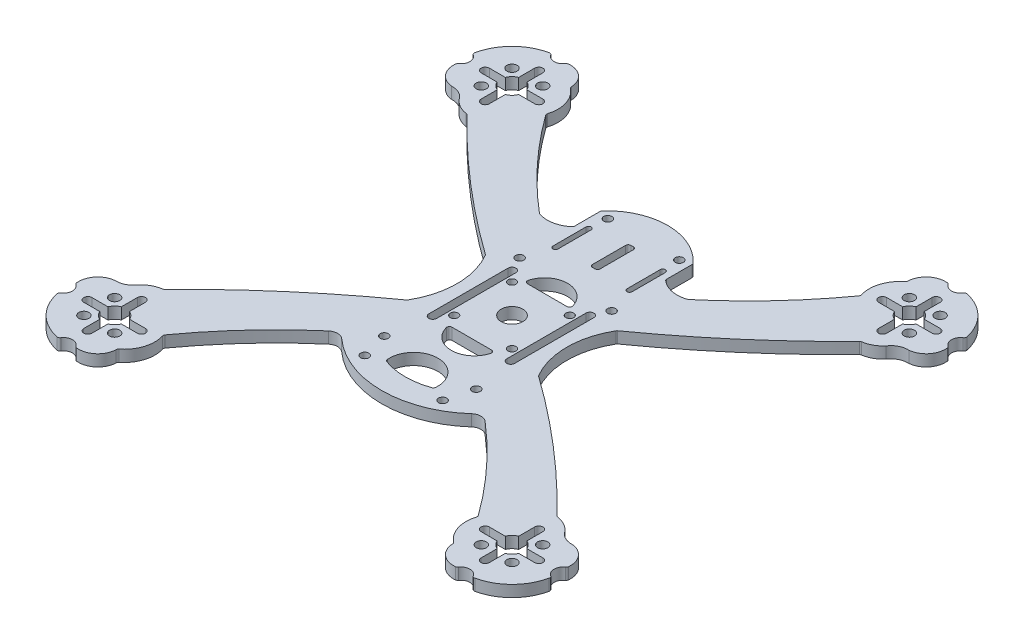
from build123d import *

# Parameters (mm, degrees)
SKETCH1_R           = 4.25
SKETCH1_R_2         = 1.598962018
SKETCH1_R_3         = 1.6
SKETCH1_R_4         = 2
SKETCH1_R_5         = 1.55
BOSS_EXTRUDE1_DEPTH = 4.5


with BuildPart() as part:
    # Sketch1 → Boss-Extrude1 (new body)
    with BuildSketch(Plane(origin=(0, 0, 0), x_dir=(1, 0, 0), z_dir=(0, 1, 0))):
        with BuildLine():
            Line((-18, 52.491933385), (-18, 42.570977291))
            ThreePointArc((-18, 42.570977291), (-18.090991941, 42.154198754), (-18.347408697, 41.813267193))
            ThreePointArc((-18.347408697, 41.813267193), (-23.441061006, 39.374833013), (-29.069059648, 39.840543614))
            ThreePointArc((-29.069059648, 39.840543614), (-46.242097232, 56.168911766), (-61.280064427, 74.482523343))
            ThreePointArc((-61.280064427, 74.482523343), (-61.456366133, 74.905913234), (-61.425121286, 75.363477492))
            ThreePointArc((-61.425121286, 75.363477492), (-61.435728809, 82.479879715), (-65.474944912, 88.338892122))
            ThreePointArc((-65.474944912, 88.338892122), (-65.747874857, 88.670909663), (-65.856229628, 89.086825095))
            ThreePointArc((-65.856229628, 89.086825095), (-68.450053895, 94.477324161), (-74.161620196, 96.255923301))
            ThreePointArc((-74.161620196, 96.255923301), (-74.56967441, 96.118270285), (-74.882001171, 95.821776459))
            ThreePointArc((-74.882001171, 95.821776459), (-77.834587411, 94.282144842), (-80.739343567, 95.910218153))
            ThreePointArc((-80.739343567, 95.910218153), (-81.19783031, 96.297768091), (-81.795628437, 96.352926486))
            ThreePointArc((-81.795628437, 96.352926486), (-91.216774773, 91.216774773), (-96.352926486, 81.795628437))
            ThreePointArc((-96.352926486, 81.795628437), (-96.297768091, 81.19783031), (-95.910218153, 80.739343567))
            ThreePointArc((-95.910218153, 80.739343567), (-94.282144842, 77.834587411), (-95.821776459, 74.882001171))
            ThreePointArc((-95.821776459, 74.882001171), (-96.118270285, 74.56967441), (-96.255923301, 74.161620196))
            ThreePointArc((-96.255923301, 74.161620196), (-94.617691402, 68.617541437), (-89.522844818, 65.885664551))
            ThreePointArc((-89.522844818, 65.885664551), (-86.143125747, 65.166719854), (-83.568706708, 62.861996642))
            ThreePointArc((-83.568706708, 62.861996642), (-80.785545253, 60.601132575), (-77.383755967, 59.467411415))
            ThreePointArc((-77.383755967, 59.467411415), (-77.071834811, 59.368965953), (-76.808366054, 59.175134765))
            ThreePointArc((-76.808366054, 59.175134765), (-52.323856067, 36.182422268), (-25.889539848, 15.46086385))
            ThreePointArc((-25.889539848, 15.46086385), (-25.732321944, 15.321426967), (-25.607714921, 15.152213482))
            ThreePointArc((-25.607714921, 15.152213482), (-22.545133808, 7.849568384), (-21.5, 0))
            ThreePointArc((-21.5, 0), (-22.545133808, -7.849568384), (-25.607714921, -15.152213482))
            ThreePointArc((-25.607714921, -15.152213482), (-25.732321944, -15.321426967), (-25.889539848, -15.46086385))
            ThreePointArc((-25.889539848, -15.46086385), (-52.323856067, -36.182422268), (-76.808366054, -59.175134765))
            ThreePointArc((-76.808366054, -59.175134765), (-77.071834811, -59.368965953), (-77.383755967, -59.467411415))
            ThreePointArc((-77.383755967, -59.467411415), (-80.785545253, -60.601132575), (-83.568706708, -62.861996642))
            ThreePointArc((-83.568706708, -62.861996642), (-86.143125747, -65.166719854), (-89.522844818, -65.885664551))
            ThreePointArc((-89.522844818, -65.885664551), (-94.617691402, -68.617541437), (-96.255923301, -74.161620196))
            ThreePointArc((-96.255923301, -74.161620196), (-96.118270285, -74.56967441), (-95.821776459, -74.882001171))
            ThreePointArc((-95.821776459, -74.882001171), (-94.282144842, -77.834587411), (-95.910218153, -80.739343567))
            ThreePointArc((-95.910218153, -80.739343567), (-96.297768091, -81.19783031), (-96.352926486, -81.795628437))
            ThreePointArc((-96.352926486, -81.795628437), (-91.216774773, -91.216774773), (-81.795628437, -96.352926486))
            ThreePointArc((-81.795628437, -96.352926486), (-81.19783031, -96.297768091), (-80.739343567, -95.910218153))
            ThreePointArc((-80.739343567, -95.910218153), (-77.834587411, -94.282144842), (-74.882001171, -95.821776459))
            ThreePointArc((-74.882001171, -95.821776459), (-74.56967441, -96.118270285), (-74.161620196, -96.255923301))
            ThreePointArc((-74.161620196, -96.255923301), (-68.450053895, -94.477324161), (-65.856229628, -89.086825095))
            ThreePointArc((-65.856229628, -89.086825095), (-65.747874857, -88.670909663), (-65.474944912, -88.338892122))
            ThreePointArc((-65.474944912, -88.338892122), (-61.435728809, -82.479879715), (-61.425121286, -75.363477492))
            ThreePointArc((-61.425121286, -75.363477492), (-61.456366133, -74.905913234), (-61.280064427, -74.482523343))
            ThreePointArc((-61.280064427, -74.482523343), (-46.958418673, -56.943537942), (-30.677364166, -41.206549342))
            ThreePointArc((-30.677364166, -41.206549342), (-28.026439142, -40.241312521), (-25.397813923, -41.265722137))
            ThreePointArc((-25.397813923, -41.265722137), (0, -51), (25.397813923, -41.265722137))
            ThreePointArc((25.397813923, -41.265722137), (28.026439142, -40.241312521), (30.677364166, -41.206549342))
            ThreePointArc((30.677364166, -41.206549342), (46.958418673, -56.943537942), (61.280064427, -74.482523343))
            ThreePointArc((61.280064427, -74.482523343), (61.456366133, -74.905913234), (61.425121286, -75.363477492))
            ThreePointArc((61.425121286, -75.363477492), (61.435728809, -82.479879715), (65.474944912, -88.338892122))
            ThreePointArc((65.474944912, -88.338892122), (65.747874857, -88.670909663), (65.856229628, -89.086825095))
            ThreePointArc((65.856229628, -89.086825095), (68.450053895, -94.477324161), (74.161620196, -96.255923301))
            ThreePointArc((74.161620196, -96.255923301), (74.56967441, -96.118270285), (74.882001171, -95.821776459))
            ThreePointArc((74.882001171, -95.821776459), (77.834587411, -94.282144842), (80.739343567, -95.910218153))
            ThreePointArc((80.739343567, -95.910218153), (81.19783031, -96.297768091), (81.795628437, -96.352926486))
            ThreePointArc((81.795628437, -96.352926486), (91.216774773, -91.216774773), (96.352926486, -81.795628437))
            ThreePointArc((96.352926486, -81.795628437), (96.297768091, -81.19783031), (95.910218153, -80.739343567))
            ThreePointArc((95.910218153, -80.739343567), (94.282144842, -77.834587411), (95.821776459, -74.882001171))
            ThreePointArc((95.821776459, -74.882001171), (96.118270285, -74.56967441), (96.255923301, -74.161620196))
            ThreePointArc((96.255923301, -74.161620196), (94.617691402, -68.617541437), (89.522844818, -65.885664551))
            ThreePointArc((89.522844818, -65.885664551), (86.143125747, -65.166719854), (83.568706708, -62.861996642))
            ThreePointArc((83.568706708, -62.861996642), (80.785545253, -60.601132575), (77.383755967, -59.467411415))
            ThreePointArc((77.383755967, -59.467411415), (77.071834811, -59.368965953), (76.808366054, -59.175134765))
            ThreePointArc((76.808366054, -59.175134765), (52.323856067, -36.182422268), (25.889539848, -15.46086385))
            ThreePointArc((25.889539848, -15.46086385), (25.732321944, -15.321426967), (25.607714921, -15.152213482))
            ThreePointArc((25.607714921, -15.152213482), (22.545133808, -7.849568384), (21.5, 0))
            ThreePointArc((21.5, 0), (22.545133808, 7.849568384), (25.607714921, 15.152213482))
            ThreePointArc((25.607714921, 15.152213482), (25.732321944, 15.321426967), (25.889539848, 15.46086385))
            ThreePointArc((25.889539848, 15.46086385), (52.323856067, 36.182422268), (76.808366054, 59.175134765))
            ThreePointArc((76.808366054, 59.175134765), (77.071834811, 59.368965953), (77.383755967, 59.467411415))
            ThreePointArc((77.383755967, 59.467411415), (80.785545253, 60.601132575), (83.568706708, 62.861996642))
            ThreePointArc((83.568706708, 62.861996642), (86.143125747, 65.166719854), (89.522844818, 65.885664551))
            ThreePointArc((89.522844818, 65.885664551), (94.617691402, 68.617541437), (96.255923301, 74.161620196))
            ThreePointArc((96.255923301, 74.161620196), (96.118270285, 74.56967441), (95.821776459, 74.882001171))
            ThreePointArc((95.821776459, 74.882001171), (94.282144842, 77.834587411), (95.910218153, 80.739343567))
            ThreePointArc((95.910218153, 80.739343567), (96.297768091, 81.19783031), (96.352926486, 81.795628437))
            ThreePointArc((96.352926486, 81.795628437), (91.216774773, 91.216774773), (81.795628437, 96.352926486))
            ThreePointArc((81.795628437, 96.352926486), (81.19783031, 96.297768091), (80.739343567, 95.910218153))
            ThreePointArc((80.739343567, 95.910218153), (77.834587411, 94.282144842), (74.882001171, 95.821776459))
            ThreePointArc((74.882001171, 95.821776459), (74.56967441, 96.118270285), (74.161620196, 96.255923301))
            ThreePointArc((74.161620196, 96.255923301), (68.450053895, 94.477324161), (65.856229628, 89.086825095))
            ThreePointArc((65.856229628, 89.086825095), (65.747874857, 88.670909663), (65.474944912, 88.338892122))
            ThreePointArc((65.474944912, 88.338892122), (61.435728809, 82.479879715), (61.425121286, 75.363477492))
            ThreePointArc((61.425121286, 75.363477492), (61.456366133, 74.905913234), (61.280064427, 74.482523343))
            ThreePointArc((61.280064427, 74.482523343), (46.242097232, 56.168911766), (29.069059648, 39.840543614))
            ThreePointArc((29.069059648, 39.840543614), (23.441061006, 39.374833013), (18.347408697, 41.813267193))
            ThreePointArc((18.347408697, 41.813267193), (18.090991941, 42.154198754), (18, 42.570977291))
            Line((18, 42.570977291), (18, 52.491933385))
            ThreePointArc((18, 52.491933385), (17.932504808, 52.853090944), (17.739130435, 53.165495706))
            ThreePointArc((17.739130435, 53.165495706), (0, 61), (-17.739130435, 53.165495706))
            ThreePointArc((-17.739130435, 53.165495706), (-17.932504808, 52.853090944), (-18, 52.491933385))
        make_face()
        with Locations(Location((0, 0, 0), (0, 0, 270))):
            Circle(SKETCH1_R, mode=Mode.SUBTRACT)
        with Locations(Location((-14, 51.5, 0), (0, 0, 270))):
            Circle(SKETCH1_R_2, mode=Mode.SUBTRACT)
        with Locations(Location((14, 51.5, 0), (0, 0, 270))):
            Circle(SKETCH1_R_2, mode=Mode.SUBTRACT)
        with Locations(Location((-18, -32, 0), (0, 0, 270))):
            Circle(SKETCH1_R_3, mode=Mode.SUBTRACT)
        with Locations(Location((18, -32, 0), (0, 0, 270))):
            Circle(SKETCH1_R_3, mode=Mode.SUBTRACT)
        with Locations(Location((83.792153571, 83.792153571, 0), (0, 0, 270))):
            Circle(SKETCH1_R_4, mode=Mode.SUBTRACT)
        with Locations(Location((71.77133829, 83.792153571, 0), (0, 0, 270))):
            Circle(SKETCH1_R_4, mode=Mode.SUBTRACT)
        with Locations(Location((83.792153571, 71.77133829, 0), (0, 0, 270))):
            Circle(SKETCH1_R_4, mode=Mode.SUBTRACT)
        with Locations(Location((-83.792153571, 83.792153571, 0), (0, 0, 270))):
            Circle(SKETCH1_R_4, mode=Mode.SUBTRACT)
        with Locations(Location((-71.77133829, 83.792153571, 0), (0, 0, 270))):
            Circle(SKETCH1_R_4, mode=Mode.SUBTRACT)
        with Locations(Location((-83.792153571, 71.77133829, 0), (0, 0, 270))):
            Circle(SKETCH1_R_4, mode=Mode.SUBTRACT)
        with Locations(Location((11.313708499, -11.313708499, 0), (0, 0, 270))):
            Circle(SKETCH1_R_5, mode=Mode.SUBTRACT)
        with Locations(Location((11.313708499, 11.313708499, 0), (0, 0, 270))):
            Circle(SKETCH1_R_5, mode=Mode.SUBTRACT)
        with Locations(Location((-11.313708499, -11.313708499, 0), (0, 0, 270))):
            Circle(SKETCH1_R_5, mode=Mode.SUBTRACT)
        with Locations(Location((-11.313708499, 11.313708499, 0), (0, 0, 270))):
            Circle(SKETCH1_R_5, mode=Mode.SUBTRACT)
        with Locations(Location((83.792153571, -83.792153571, 0), (0, 0, 270))):
            Circle(SKETCH1_R_4, mode=Mode.SUBTRACT)
        with Locations(Location((71.77133829, -83.792153571, 0), (0, 0, 270))):
            Circle(SKETCH1_R_4, mode=Mode.SUBTRACT)
        with Locations(Location((83.792153571, -71.77133829, 0), (0, 0, 270))):
            Circle(SKETCH1_R_4, mode=Mode.SUBTRACT)
        with Locations(Location((-83.792153571, -83.792153571, 0), (0, 0, 270))):
            Circle(SKETCH1_R_4, mode=Mode.SUBTRACT)
        with Locations(Location((-71.77133829, -83.792153571, 0), (0, 0, 270))):
            Circle(SKETCH1_R_4, mode=Mode.SUBTRACT)
        with Locations(Location((-83.792153571, -71.77133829, 0), (0, 0, 270))):
            Circle(SKETCH1_R_4, mode=Mode.SUBTRACT)
        with Locations(Location((-18, 21, 0), (0, 0, 270))):
            Circle(SKETCH1_R_3, mode=Mode.SUBTRACT)
        with Locations(Location((18, 21, 0), (0, 0, 270))):
            Circle(SKETCH1_R_3, mode=Mode.SUBTRACT)
        with Locations(Location((15.25, -42.413337353, 0), (0, 0, 270))):
            Circle(SKETCH1_R_3, mode=Mode.SUBTRACT)
        with Locations(Location((-15.25, -42.413337353, 0), (0, 0, 270))):
            Circle(SKETCH1_R_3, mode=Mode.SUBTRACT)
        with BuildLine():
            Line((-13.5, 44.5), (-13.5, 31.5))
            ThreePointArc((-13.5, 31.5), (-14.5, 30.5), (-15.5, 31.5))
            Line((-15.5, 31.5), (-15.5, 44.5))
            ThreePointArc((-15.5, 44.5), (-14.5, 45.5), (-13.5, 44.5))
        make_face(mode=Mode.SUBTRACT)
        with BuildLine():
            Line((15.5, 44.5), (15.5, 31.5))
            ThreePointArc((15.5, 31.5), (14.5, 30.5), (13.5, 31.5))
            Line((13.5, 31.5), (13.5, 44.5))
            ThreePointArc((13.5, 44.5), (14.5, 45.5), (15.5, 44.5))
        make_face(mode=Mode.SUBTRACT)
        with BuildLine():
            Line((79.381745931, 67.281745931), (79.381745931, 73.575797762))
            ThreePointArc((79.381745931, 73.575797762), (80.963726446, 74.599765415), (81.987694099, 76.181745931))
            Line((81.987694099, 76.181745931), (88.281745931, 76.181745931))
            ThreePointArc((88.281745931, 76.181745931), (89.881745931, 77.781745931), (88.281745931, 79.381745931))
            Line((88.281745931, 79.381745931), (81.987694099, 79.381745931))
            ThreePointArc((81.987694099, 79.381745931), (80.963726446, 80.963726446), (79.381745931, 81.987694099))
            Line((79.381745931, 81.987694099), (79.381745931, 88.281745931))
            ThreePointArc((79.381745931, 88.281745931), (77.781745931, 89.881745931), (76.181745931, 88.281745931))
            Line((76.181745931, 88.281745931), (76.181745931, 81.987694099))
            ThreePointArc((76.181745931, 81.987694099), (74.599765415, 80.963726446), (73.575797762, 79.381745931))
            Line((73.575797762, 79.381745931), (67.281745931, 79.381745931))
            ThreePointArc((67.281745931, 79.381745931), (65.681745931, 77.781745931), (67.281745931, 76.181745931))
            Line((67.281745931, 76.181745931), (73.575797762, 76.181745931))
            ThreePointArc((73.575797762, 76.181745931), (74.599765415, 74.599765415), (76.181745931, 73.575797762))
            Line((76.181745931, 73.575797762), (76.181745931, 67.281745931))
            ThreePointArc((76.181745931, 67.281745931), (77.781745931, 65.681745931), (79.381745931, 67.281745931))
        make_face(mode=Mode.SUBTRACT)
        with BuildLine():
            Line((-79.381745931, 67.281745931), (-79.381745931, 73.575797762))
            ThreePointArc((-79.381745931, 73.575797762), (-80.963726446, 74.599765415), (-81.987694099, 76.181745931))
            Line((-81.987694099, 76.181745931), (-88.281745931, 76.181745931))
            ThreePointArc((-88.281745931, 76.181745931), (-89.881745931, 77.781745931), (-88.281745931, 79.381745931))
            Line((-88.281745931, 79.381745931), (-81.987694099, 79.381745931))
            ThreePointArc((-81.987694099, 79.381745931), (-80.963726446, 80.963726446), (-79.381745931, 81.987694099))
            Line((-79.381745931, 81.987694099), (-79.381745931, 88.281745931))
            ThreePointArc((-79.381745931, 88.281745931), (-77.781745931, 89.881745931), (-76.181745931, 88.281745931))
            Line((-76.181745931, 88.281745931), (-76.181745931, 81.987694099))
            ThreePointArc((-76.181745931, 81.987694099), (-74.599765415, 80.963726446), (-73.575797762, 79.381745931))
            Line((-73.575797762, 79.381745931), (-67.281745931, 79.381745931))
            ThreePointArc((-67.281745931, 79.381745931), (-65.681745931, 77.781745931), (-67.281745931, 76.181745931))
            Line((-67.281745931, 76.181745931), (-73.575797762, 76.181745931))
            ThreePointArc((-73.575797762, 76.181745931), (-74.599765415, 74.599765415), (-76.181745931, 73.575797762))
            Line((-76.181745931, 73.575797762), (-76.181745931, 67.281745931))
            ThreePointArc((-76.181745931, 67.281745931), (-77.781745931, 65.681745931), (-79.381745931, 67.281745931))
        make_face(mode=Mode.SUBTRACT)
        with BuildLine():
            Line((79.381745931, -67.281745931), (79.381745931, -73.575797762))
            ThreePointArc((79.381745931, -73.575797762), (80.963726446, -74.599765415), (81.987694099, -76.181745931))
            Line((81.987694099, -76.181745931), (88.281745931, -76.181745931))
            ThreePointArc((88.281745931, -76.181745931), (89.881745931, -77.781745931), (88.281745931, -79.381745931))
            Line((88.281745931, -79.381745931), (81.987694099, -79.381745931))
            ThreePointArc((81.987694099, -79.381745931), (80.963726446, -80.963726446), (79.381745931, -81.987694099))
            Line((79.381745931, -81.987694099), (79.381745931, -88.281745931))
            ThreePointArc((79.381745931, -88.281745931), (77.781745931, -89.881745931), (76.181745931, -88.281745931))
            Line((76.181745931, -88.281745931), (76.181745931, -81.987694099))
            ThreePointArc((76.181745931, -81.987694099), (74.599765415, -80.963726446), (73.575797762, -79.381745931))
            Line((73.575797762, -79.381745931), (67.281745931, -79.381745931))
            ThreePointArc((67.281745931, -79.381745931), (65.681745931, -77.781745931), (67.281745931, -76.181745931))
            Line((67.281745931, -76.181745931), (73.575797762, -76.181745931))
            ThreePointArc((73.575797762, -76.181745931), (74.599765415, -74.599765415), (76.181745931, -73.575797762))
            Line((76.181745931, -73.575797762), (76.181745931, -67.281745931))
            ThreePointArc((76.181745931, -67.281745931), (77.781745931, -65.681745931), (79.381745931, -67.281745931))
        make_face(mode=Mode.SUBTRACT)
        with BuildLine():
            Line((-79.381745931, -67.281745931), (-79.381745931, -73.575797762))
            ThreePointArc((-79.381745931, -73.575797762), (-80.963726446, -74.599765415), (-81.987694099, -76.181745931))
            Line((-81.987694099, -76.181745931), (-88.281745931, -76.181745931))
            ThreePointArc((-88.281745931, -76.181745931), (-89.881745931, -77.781745931), (-88.281745931, -79.381745931))
            Line((-88.281745931, -79.381745931), (-81.987694099, -79.381745931))
            ThreePointArc((-81.987694099, -79.381745931), (-80.963726446, -80.963726446), (-79.381745931, -81.987694099))
            Line((-79.381745931, -81.987694099), (-79.381745931, -88.281745931))
            ThreePointArc((-79.381745931, -88.281745931), (-77.781745931, -89.881745931), (-76.181745931, -88.281745931))
            Line((-76.181745931, -88.281745931), (-76.181745931, -81.987694099))
            ThreePointArc((-76.181745931, -81.987694099), (-74.599765415, -80.963726446), (-73.575797762, -79.381745931))
            Line((-73.575797762, -79.381745931), (-67.281745931, -79.381745931))
            ThreePointArc((-67.281745931, -79.381745931), (-65.681745931, -77.781745931), (-67.281745931, -76.181745931))
            Line((-67.281745931, -76.181745931), (-73.575797762, -76.181745931))
            ThreePointArc((-73.575797762, -76.181745931), (-74.599765415, -74.599765415), (-76.181745931, -73.575797762))
            Line((-76.181745931, -73.575797762), (-76.181745931, -67.281745931))
            ThreePointArc((-76.181745931, -67.281745931), (-77.781745931, -65.681745931), (-79.381745931, -67.281745931))
        make_face(mode=Mode.SUBTRACT)
        with BuildLine():
            Line((1.5, 46), (1.5, 33))
            ThreePointArc((1.5, 33), (1.207106781, 32.292893219), (0.5, 32))
            Line((0.5, 32), (-0.5, 32))
            ThreePointArc((-0.5, 32), (-1.207106781, 32.292893219), (-1.5, 33))
            Line((-1.5, 33), (-1.5, 46))
            ThreePointArc((-1.5, 46), (-1.207106781, 46.707106781), (-0.5, 47))
            Line((-0.5, 47), (0.5, 47))
            ThreePointArc((0.5, 47), (1.207106781, 46.707106781), (1.5, 46))
        make_face(mode=Mode.SUBTRACT)
        with BuildLine():
            Line((-13.7, 15.25), (-13.7, -15.75))
            ThreePointArc((-13.7, -15.75), (-15.25, -17.3), (-16.8, -15.75))
            Line((-16.8, -15.75), (-16.8, 15.25))
            ThreePointArc((-16.8, 15.25), (-15.25, 16.8), (-13.7, 15.25))
        make_face(mode=Mode.SUBTRACT)
        with BuildLine():
            Line((-7.745966692, -15.75), (7.745966692, -15.75))
            ThreePointArc((7.745966692, -15.75), (8.536536107, -16.137627564), (8.714212529, -17))
            ThreePointArc((8.714212529, -17), (0, -23.75), (-8.714212529, -17))
            ThreePointArc((-8.714212529, -17), (-8.536536107, -16.137627564), (-7.745966692, -15.75))
        make_face(mode=Mode.SUBTRACT)
        with BuildLine():
            Line((13.7, 15.25), (13.7, -15.75))
            ThreePointArc((13.7, -15.75), (15.25, -17.3), (16.8, -15.75))
            Line((16.8, -15.75), (16.8, 15.25))
            ThreePointArc((16.8, 15.25), (15.25, 16.8), (13.7, 15.25))
        make_face(mode=Mode.SUBTRACT)
        with BuildLine():
            Line((-7.745966692, 13.75), (7.745966692, 13.75))
            ThreePointArc((7.745966692, 13.75), (8.536536107, 14.137627564), (8.714212529, 15))
            ThreePointArc((8.714212529, 15), (0, 21.75), (-8.714212529, 15))
            ThreePointArc((-8.714212529, 15), (-8.536536107, 14.137627564), (-7.745966692, 13.75))
        make_face(mode=Mode.SUBTRACT)
        with BuildLine():
            ThreePointArc((-8.803163241, -40.214347875), (0, -41.75), (8.803163241, -40.214347875))
            ThreePointArc((8.803163241, -40.214347875), (9.255580194, -39.885227366), (9.460412985, -39.364607603))
            ThreePointArc((9.460412985, -39.364607603), (0, -28.998243847), (-9.460412985, -39.364607603))
            ThreePointArc((-9.460412985, -39.364607603), (-9.255580194, -39.885227366), (-8.803163241, -40.214347875))
        make_face(mode=Mode.SUBTRACT)
    extrude(amount=BOSS_EXTRUDE1_DEPTH)


solid = part.part
